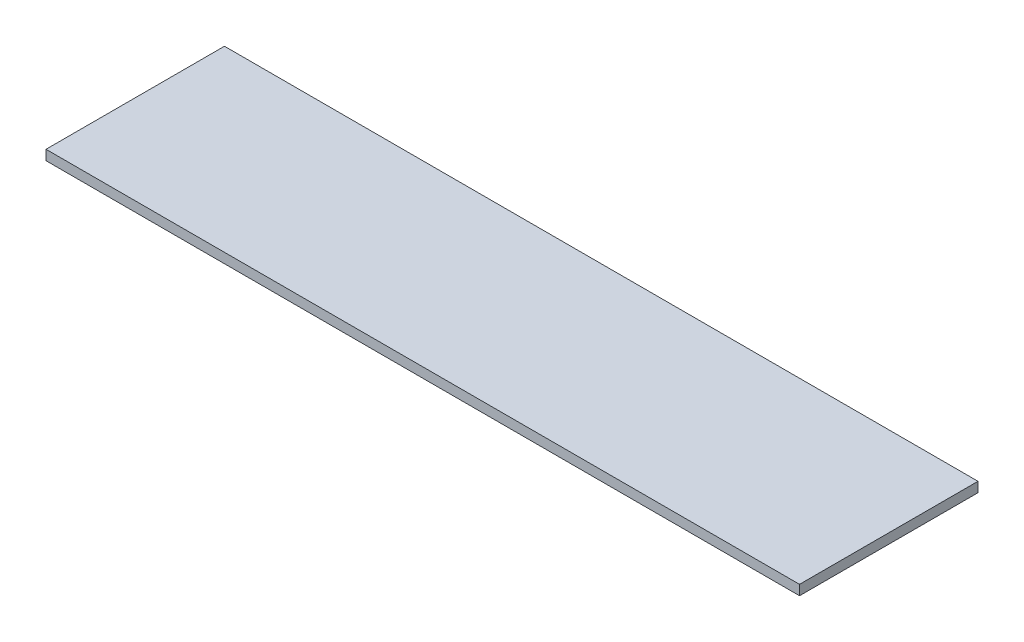
from build123d import *

# Parameters (mm, degrees)
SKETCH1_W           = 241.3
SKETCH1_H           = 57.15
BOSS_EXTRUDE1_DEPTH = 3.175


with BuildPart() as part:
    # Sketch1 → Boss-Extrude1 (new body)
    with BuildSketch(Plane(origin=(0, 0, 0), x_dir=(1, 0, 0), z_dir=(0, 1, 0))):
        with Locations((0, 28.575)):
            Rectangle(SKETCH1_W, SKETCH1_H)
    extrude(amount=BOSS_EXTRUDE1_DEPTH)


solid = part.part
